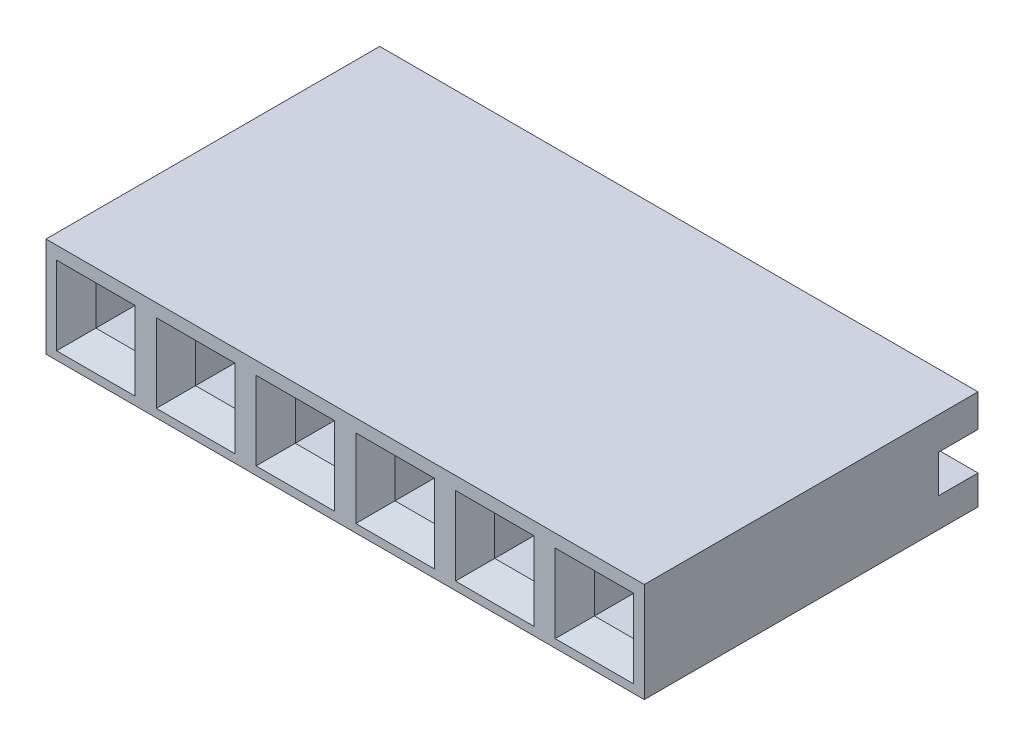
from build123d import *

# Parameters (mm, degrees)
BOSS_EXTRUDE1_DEPTH       = 15.24
SKETCH2_W                 = 2
SKETCH2_H                 = 0.6
CUT_EXTRUDE1_DEPTH        = 5.5
SKETCH3_W                 = 1
SKETCH3_H                 = 1
CUT_EXTRUDE2_DEPTH        = 6
SKETCH4_W                 = 2
SKETCH4_H                 = 2
CUT_EXTRUDE3_DEPTH        = 0.5
CUT_EXTRUDE3_DRAFT        = -45
LPATTERN1_COUNT           = 8
LPATTERN1_PITCH           = 2.54
LPATTERN1_COPY_1_SKETCH_W = 2
LPATTERN1_COPY_1_SKETCH_H = 2
LPATTERN1_COPY_1_DEPTH    = 0.5
LPATTERN1_COPY_1_DRAFT    = -45
LPATTERN1_COPY_2_SKETCH_W = 2
LPATTERN1_COPY_2_SKETCH_H = 2
LPATTERN1_COPY_2_DEPTH    = 0.5
LPATTERN1_COPY_2_DRAFT    = -45
LPATTERN1_COPY_3_SKETCH_W = 2
LPATTERN1_COPY_3_SKETCH_H = 2
LPATTERN1_COPY_3_DEPTH    = 0.5
LPATTERN1_COPY_3_DRAFT    = -45
LPATTERN1_COPY_4_SKETCH_W = 2
LPATTERN1_COPY_4_SKETCH_H = 2
LPATTERN1_COPY_4_DEPTH    = 0.5
LPATTERN1_COPY_4_DRAFT    = -45
LPATTERN1_COPY_5_SKETCH_W = 2
LPATTERN1_COPY_5_SKETCH_H = 2
LPATTERN1_COPY_5_DEPTH    = 0.5
LPATTERN1_COPY_5_DRAFT    = -45
LPATTERN1_COPY_6_SKETCH_W = 2
LPATTERN1_COPY_6_SKETCH_H = 2
LPATTERN1_COPY_6_DEPTH    = 0.5
LPATTERN1_COPY_6_DRAFT    = -45
LPATTERN1_COPY_7_SKETCH_W = 2
LPATTERN1_COPY_7_SKETCH_H = 2
LPATTERN1_COPY_7_DEPTH    = 0.5
LPATTERN1_COPY_7_DRAFT    = -45


with BuildPart() as part:
    # Sketch1 → Boss-Extrude1 (new body)
    with BuildSketch(Plane(origin=(0, 0, 0), x_dir=(0, 0, -1), z_dir=(1, 0, 0))):
        Polygon((8.5, 2.54), (0, 2.54), (0, 0), (8.5, 0), (8.5, 0.75), (7.5, 0.75), (7.5, 1.709993), (8.5, 1.709993), align=None)
    extrude(amount=-BOSS_EXTRUDE1_DEPTH)

    # Sketch2 → Cut-Extrude1 (cut)
    with BuildSketch(Plane(origin=(0, 0, -7.5), x_dir=(-1, 0, 0), z_dir=(0, 0, -1))):
        with Locations((1.27, 1.409993)):
            Rectangle(SKETCH2_W, SKETCH2_H)
    cut_extrude1 = extrude(amount=-CUT_EXTRUDE1_DEPTH, mode=Mode.SUBTRACT)

    # Sketch3 → Cut-Extrude2 (cut)
    with BuildSketch(Plane(origin=(0, 0, 0), x_dir=(-1, 0, 0), z_dir=(0, 0, -1))):
        with Locations((1.27, 1.209993)):
            Rectangle(SKETCH3_W, SKETCH3_H)
    cut_extrude2 = extrude(amount=CUT_EXTRUDE2_DEPTH, mode=Mode.SUBTRACT)


with BuildPart() as cut_extrude3_tool:
    # Sketch4 → Cut-Extrude3 (with draft: the straight prism first)
    with BuildSketch(Plane.XY):
        with Locations((-1.27, 1.209993)):
            Rectangle(SKETCH4_W, SKETCH4_H)
    extrude(amount=-CUT_EXTRUDE3_DEPTH)
    # Cut-Extrude3: the draft: its side faces are tilted about the plane it starts from
    cut_extrude3_sides = [cut_extrude3_tool.faces().sort_by_distance(p)[0] for p in [
        (-2.27, 1.209993, -0.25),
        (-1.27, 0.209993, -0.25),
        (-0.27, 1.209993, -0.25),
        (-1.27, 2.209993, -0.25),
    ]]
    draft(cut_extrude3_sides, Plane.XY, CUT_EXTRUDE3_DRAFT)


with BuildPart() as part_1:
    add(part.part)

    # Cut-Extrude3: cut by cut_extrude3_tool
    add(cut_extrude3_tool.part, mode=Mode.SUBTRACT)

    # LPattern1: Cut-Extrude1, Cut-Extrude2 ×8
    with Locations(*[(-i * LPATTERN1_PITCH, 0, 0) for i in range(1, LPATTERN1_COUNT)]):
        add(cut_extrude1, mode=Mode.SUBTRACT)
        add(cut_extrude2, mode=Mode.SUBTRACT)


with BuildPart() as lpattern1_copy_1_tool:
    # LPattern1 copy 1 sketch → LPattern1 copy 1 (with draft: the straight prism first)
    with BuildSketch(Plane(origin=(-2.54, 0, 0), x_dir=(1, 0, 0), z_dir=(0, 0, 1))):
        with Locations((-1.27, 1.209993)):
            Rectangle(LPATTERN1_COPY_1_SKETCH_W, LPATTERN1_COPY_1_SKETCH_H)
    extrude(amount=-LPATTERN1_COPY_1_DEPTH)
    # LPattern1 copy 1: the draft: its side faces are tilted about the plane it starts from
    lpattern1_copy_1_sides = [lpattern1_copy_1_tool.faces().sort_by_distance(p)[0] for p in [
        (-4.81, 1.209993, -0.25),
        (-3.81, 0.209993, -0.25),
        (-2.81, 1.209993, -0.25),
        (-3.81, 2.209993, -0.25),
    ]]
    draft(lpattern1_copy_1_sides, Plane(origin=(-2.54, 0, 0), x_dir=(1, 0, 0), z_dir=(0, 0, 1)), LPATTERN1_COPY_1_DRAFT)


with BuildPart() as part_2:
    add(part_1.part)

    # LPattern1 copy 1: cut by lpattern1_copy_1_tool
    add(lpattern1_copy_1_tool.part, mode=Mode.SUBTRACT)


with BuildPart() as lpattern1_copy_2_tool:
    # LPattern1 copy 2 sketch → LPattern1 copy 2 (with draft: the straight prism first)
    with BuildSketch(Plane(origin=(-5.08, 0, 0), x_dir=(1, 0, 0), z_dir=(0, 0, 1))):
        with Locations((-1.27, 1.209993)):
            Rectangle(LPATTERN1_COPY_2_SKETCH_W, LPATTERN1_COPY_2_SKETCH_H)
    extrude(amount=-LPATTERN1_COPY_2_DEPTH)
    # LPattern1 copy 2: the draft: its side faces are tilted about the plane it starts from
    lpattern1_copy_2_sides = [lpattern1_copy_2_tool.faces().sort_by_distance(p)[0] for p in [
        (-7.35, 1.209993, -0.25),
        (-6.35, 0.209993, -0.25),
        (-5.35, 1.209993, -0.25),
        (-6.35, 2.209993, -0.25),
    ]]
    draft(lpattern1_copy_2_sides, Plane(origin=(-5.08, 0, 0), x_dir=(1, 0, 0), z_dir=(0, 0, 1)), LPATTERN1_COPY_2_DRAFT)


with BuildPart() as part_3:
    add(part_2.part)

    # LPattern1 copy 2: cut by lpattern1_copy_2_tool
    add(lpattern1_copy_2_tool.part, mode=Mode.SUBTRACT)


with BuildPart() as lpattern1_copy_3_tool:
    # LPattern1 copy 3 sketch → LPattern1 copy 3 (with draft: the straight prism first)
    with BuildSketch(Plane(origin=(-7.62, 0, 0), x_dir=(1, 0, 0), z_dir=(0, 0, 1))):
        with Locations((-1.27, 1.209993)):
            Rectangle(LPATTERN1_COPY_3_SKETCH_W, LPATTERN1_COPY_3_SKETCH_H)
    extrude(amount=-LPATTERN1_COPY_3_DEPTH)
    # LPattern1 copy 3: the draft: its side faces are tilted about the plane it starts from
    lpattern1_copy_3_sides = [lpattern1_copy_3_tool.faces().sort_by_distance(p)[0] for p in [
        (-9.89, 1.209993, -0.25),
        (-8.89, 0.209993, -0.25),
        (-7.89, 1.209993, -0.25),
        (-8.89, 2.209993, -0.25),
    ]]
    draft(lpattern1_copy_3_sides, Plane(origin=(-7.62, 0, 0), x_dir=(1, 0, 0), z_dir=(0, 0, 1)), LPATTERN1_COPY_3_DRAFT)


with BuildPart() as part_4:
    add(part_3.part)

    # LPattern1 copy 3: cut by lpattern1_copy_3_tool
    add(lpattern1_copy_3_tool.part, mode=Mode.SUBTRACT)


with BuildPart() as lpattern1_copy_4_tool:
    # LPattern1 copy 4 sketch → LPattern1 copy 4 (with draft: the straight prism first)
    with BuildSketch(Plane(origin=(-10.16, 0, 0), x_dir=(1, 0, 0), z_dir=(0, 0, 1))):
        with Locations((-1.27, 1.209993)):
            Rectangle(LPATTERN1_COPY_4_SKETCH_W, LPATTERN1_COPY_4_SKETCH_H)
    extrude(amount=-LPATTERN1_COPY_4_DEPTH)
    # LPattern1 copy 4: the draft: its side faces are tilted about the plane it starts from
    lpattern1_copy_4_sides = [lpattern1_copy_4_tool.faces().sort_by_distance(p)[0] for p in [
        (-12.43, 1.209993, -0.25),
        (-11.43, 0.209993, -0.25),
        (-10.43, 1.209993, -0.25),
        (-11.43, 2.209993, -0.25),
    ]]
    draft(lpattern1_copy_4_sides, Plane(origin=(-10.16, 0, 0), x_dir=(1, 0, 0), z_dir=(0, 0, 1)), LPATTERN1_COPY_4_DRAFT)


with BuildPart() as part_5:
    add(part_4.part)

    # LPattern1 copy 4: cut by lpattern1_copy_4_tool
    add(lpattern1_copy_4_tool.part, mode=Mode.SUBTRACT)


with BuildPart() as lpattern1_copy_5_tool:
    # LPattern1 copy 5 sketch → LPattern1 copy 5 (with draft: the straight prism first)
    with BuildSketch(Plane(origin=(-12.7, 0, 0), x_dir=(1, 0, 0), z_dir=(0, 0, 1))):
        with Locations((-1.27, 1.209993)):
            Rectangle(LPATTERN1_COPY_5_SKETCH_W, LPATTERN1_COPY_5_SKETCH_H)
    extrude(amount=-LPATTERN1_COPY_5_DEPTH)
    # LPattern1 copy 5: the draft: its side faces are tilted about the plane it starts from
    lpattern1_copy_5_sides = [lpattern1_copy_5_tool.faces().sort_by_distance(p)[0] for p in [
        (-14.97, 1.209993, -0.25),
        (-13.97, 0.209993, -0.25),
        (-12.97, 1.209993, -0.25),
        (-13.97, 2.209993, -0.25),
    ]]
    draft(lpattern1_copy_5_sides, Plane(origin=(-12.7, 0, 0), x_dir=(1, 0, 0), z_dir=(0, 0, 1)), LPATTERN1_COPY_5_DRAFT)


with BuildPart() as part_6:
    add(part_5.part)

    # LPattern1 copy 5: cut by lpattern1_copy_5_tool
    add(lpattern1_copy_5_tool.part, mode=Mode.SUBTRACT)


with BuildPart() as lpattern1_copy_6_tool:
    # LPattern1 copy 6 sketch → LPattern1 copy 6 (with draft: the straight prism first)
    with BuildSketch(Plane(origin=(-15.24, 0, 0), x_dir=(1, 0, 0), z_dir=(0, 0, 1))):
        with Locations((-1.27, 1.209993)):
            Rectangle(LPATTERN1_COPY_6_SKETCH_W, LPATTERN1_COPY_6_SKETCH_H)
    extrude(amount=-LPATTERN1_COPY_6_DEPTH)
    # LPattern1 copy 6: the draft: its side faces are tilted about the plane it starts from
    lpattern1_copy_6_sides = [lpattern1_copy_6_tool.faces().sort_by_distance(p)[0] for p in [
        (-17.51, 1.209993, -0.25),
        (-16.51, 0.209993, -0.25),
        (-15.51, 1.209993, -0.25),
        (-16.51, 2.209993, -0.25),
    ]]
    draft(lpattern1_copy_6_sides, Plane(origin=(-15.24, 0, 0), x_dir=(1, 0, 0), z_dir=(0, 0, 1)), LPATTERN1_COPY_6_DRAFT)


with BuildPart() as part_7:
    add(part_6.part)

    # LPattern1 copy 6: cut by lpattern1_copy_6_tool
    add(lpattern1_copy_6_tool.part, mode=Mode.SUBTRACT)


with BuildPart() as lpattern1_copy_7_tool:
    # LPattern1 copy 7 sketch → LPattern1 copy 7 (with draft: the straight prism first)
    with BuildSketch(Plane(origin=(-17.78, 0, 0), x_dir=(1, 0, 0), z_dir=(0, 0, 1))):
        with Locations((-1.27, 1.209993)):
            Rectangle(LPATTERN1_COPY_7_SKETCH_W, LPATTERN1_COPY_7_SKETCH_H)
    extrude(amount=-LPATTERN1_COPY_7_DEPTH)
    # LPattern1 copy 7: the draft: its side faces are tilted about the plane it starts from
    lpattern1_copy_7_sides = [lpattern1_copy_7_tool.faces().sort_by_distance(p)[0] for p in [
        (-20.05, 1.209993, -0.25),
        (-19.05, 0.209993, -0.25),
        (-18.05, 1.209993, -0.25),
        (-19.05, 2.209993, -0.25),
    ]]
    draft(lpattern1_copy_7_sides, Plane(origin=(-17.78, 0, 0), x_dir=(1, 0, 0), z_dir=(0, 0, 1)), LPATTERN1_COPY_7_DRAFT)


with BuildPart() as part_8:
    add(part_7.part)

    # LPattern1 copy 7: cut by lpattern1_copy_7_tool
    add(lpattern1_copy_7_tool.part, mode=Mode.SUBTRACT)


solid = part_8.part
